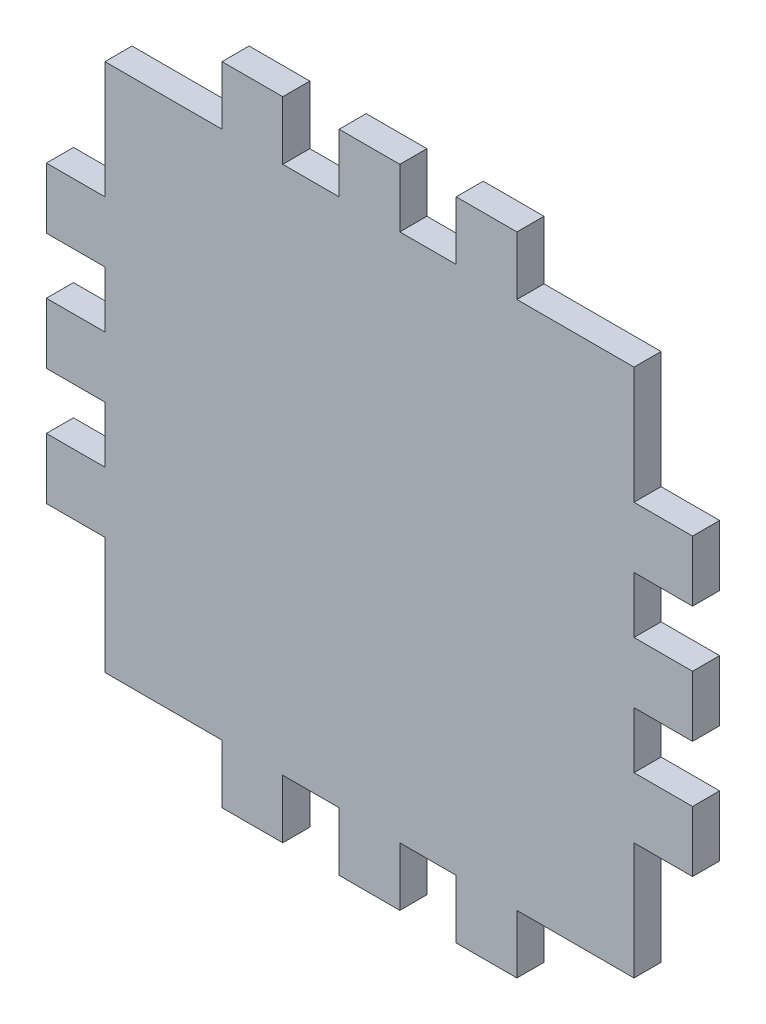
from build123d import *

# Parameters (mm, degrees)
BOSS_EXTRUDE1_DEPTH = 3.7


with BuildPart() as part:
    # Model → Boss-Extrude1 (new body)
    with BuildSketch(Plane.XY):
        Polygon((274.533340154, 180.336099211), (266.533340593, 180.336099211), (266.533340593, 196.336099312), (250.533340762, 196.336099312), (250.533340762, 204.336098873), (242.233342195, 204.336098873), (242.233342195, 196.336099312), (234.53334093, 196.336099312), (234.53334093, 204.336098873), (226.233342363, 204.336098873), (226.233342363, 196.336099312), (218.533343251, 196.336099312), (218.533343251, 204.336098873), (210.233344684, 204.336098873), (210.233344684, 196.336099312), (194.233344583, 196.336099312), (194.233344583, 180.336099211), (186.233342807, 180.336099211), (186.233342807, 172.036100644), (194.233344584, 172.036100644), (194.233344584, 164.336101533), (186.233342807, 164.336101533), (186.233342807, 156.036102966), (194.233344584, 156.036102966), (194.233344584, 148.336101701), (186.233342807, 148.336101701), (186.233342807, 140.036103134), (194.233344584, 140.036103134), (194.233344583, 124.036103302), (210.233344684, 124.036103302), (210.233344684, 116.036101526), (218.533343251, 116.036101526), (218.533343251, 124.036103302), (226.233342363, 124.036103302), (226.233342363, 116.036101526), (234.53334093, 116.036101526), (234.53334093, 124.036103302), (242.233342195, 124.036103302), (242.233342195, 116.036101526), (250.533340762, 116.036101526), (250.533340762, 124.036103302), (266.533340593, 124.036103302), (266.533340593, 140.036103134), (274.533340154, 140.036103134), (274.533340154, 148.336101701), (266.533340593, 148.336101701), (266.533340593, 156.036102966), (274.533340154, 156.036102966), (274.533340154, 164.336101533), (266.533340593, 164.336101533), (266.533340593, 172.036100644), (274.533340154, 172.036100644), align=None)
    extrude(amount=BOSS_EXTRUDE1_DEPTH)


solid = part.part
